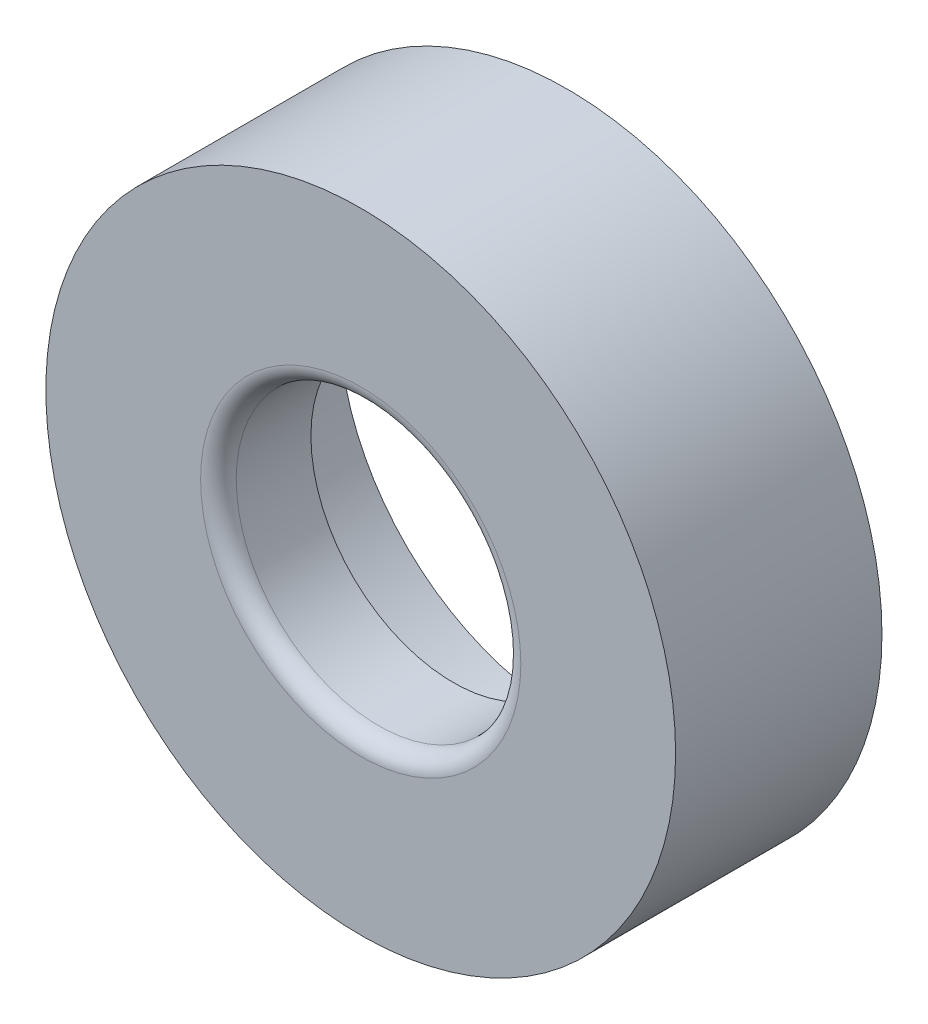
from build123d import *

# Parameters (mm, degrees)
SKETCH1_R           = 8.85
BOSS_EXTRUDE1_DEPTH = 5.8
SKETCH2_R           = 4
CUT_EXTRUDE1_DEPTH  = 95.83104607
SKETCH3_R           = 6.4
CUT_EXTRUDE2_DEPTH  = 3.2
FILLET1_R           = 0.5


with BuildPart() as part:
    # Sketch1 → Boss-Extrude1 (new body)
    with BuildSketch(Plane.XY):
        with Locations((85.206527413, -1.763997815)):
            Circle(SKETCH1_R)
    extrude(amount=BOSS_EXTRUDE1_DEPTH)

    # Sketch2 → Cut-Extrude1 (cut, through all)
    with BuildSketch(Plane.XY.offset(5.8)):
        with Locations((85.206527413, -1.763997815)):
            Circle(SKETCH2_R)
    extrude(amount=-CUT_EXTRUDE1_DEPTH, mode=Mode.SUBTRACT)

    # Sketch3 → Cut-Extrude2 (cut)
    with BuildSketch(Plane(origin=(0, 0, 0), x_dir=(-1, 0, 0), z_dir=(0, 0, -1))):
        with Locations((-85.206527413, -1.763997815)):
            Circle(SKETCH3_R)
    extrude(amount=-CUT_EXTRUDE2_DEPTH, mode=Mode.SUBTRACT)

    # Fillet1
    fillet1_edges = [part.edges().sort_by_distance(p)[0] for p in [
        (81.206527413, -1.763997815, 5.8),
    ]]
    fillet(fillet1_edges, radius=FILLET1_R)


solid = part.part
